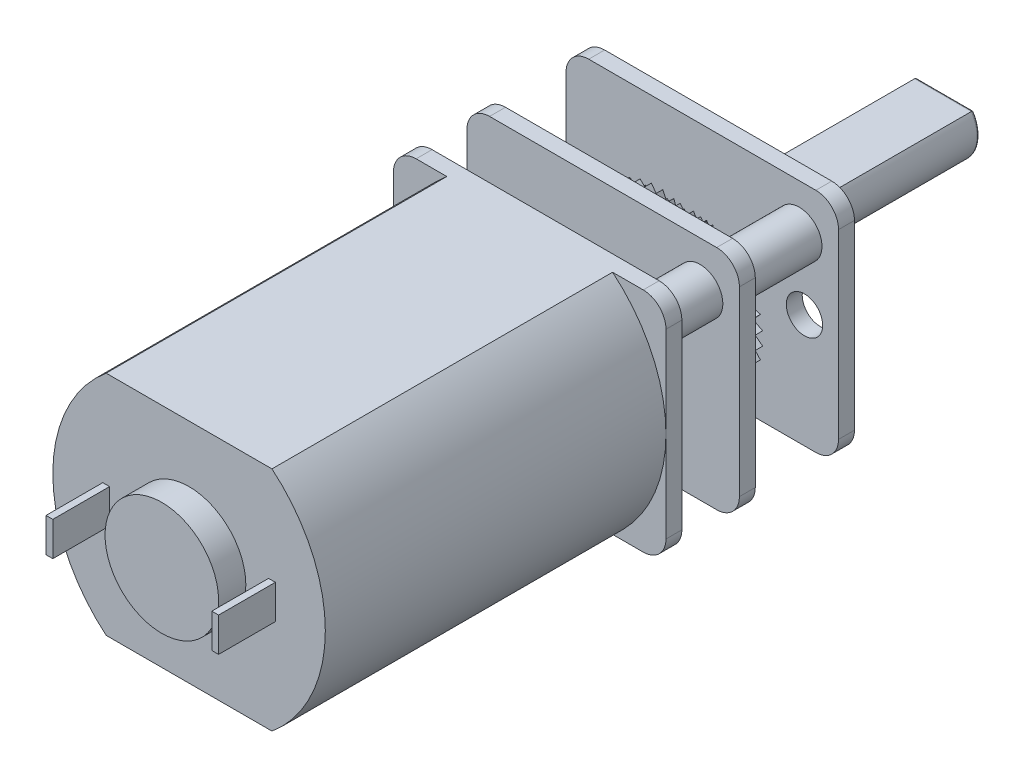
from build123d import *

# Parameters (mm, degrees)
BOSS_EXTRUDE1_DEPTH  = 9.3
SKETCH2_R            = 2
BOSS_EXTRUDE2_DEPTH  = 0.7
SKETCH3_W            = 12
SKETCH3_H            = 10
BOSS_EXTRUDE3_DEPTH  = 0.7
SKETCH4_R            = 0.8
CUT_EXTRUDE1_DEPTH   = 13.68857754
FILLET1_R            = 1
SKETCH4_3_R          = 1
BOSS_EXTRUDE5_DEPTH  = 7.6
BOSS_EXTRUDE6_START  = 0.7
BOSS_EXTRUDE6_DEPTH  = 0.7
BOSS_EXTRUDE7_DEPTH  = 15
SKETCH7_R            = 2.5
BOSS_EXTRUDE8_DEPTH  = 1.2
SKETCH7_3_W          = 0.3
SKETCH7_3_H          = 1.5
BOSS_EXTRUDE9_DEPTH  = 2.5
BOSS_EXTRUDE10_DEPTH = 0.7
FILLET2_R            = 0.1
BOSS_EXTRUDE11_DEPTH = 1
BOSS_EXTRUDE12_DEPTH = 1
BOSS_EXTRUDE13_DEPTH = 1
BOSS_EXTRUDE14_DEPTH = 0.67
SKETCH14_R           = 1
BOSS_EXTRUDE15_DEPTH = 2.5


with BuildPart() as part:
    # Sketch1 → Boss-Extrude1 (new body)
    with BuildSketch(Plane.XY):
        with BuildLine():
            Line((-1.25, 0.829156198), (1.25, 0.829156198))
            ThreePointArc((1.25, 0.829156198), (0, -1.5), (-1.25, 0.829156198))
        make_face()
    extrude(amount=BOSS_EXTRUDE1_DEPTH)

    # Sketch2 → Boss-Extrude2 (add)
    with BuildSketch(Plane.XY.offset(9.3)):
        Circle(SKETCH2_R)
    extrude(amount=BOSS_EXTRUDE2_DEPTH)

    # Sketch3 → Boss-Extrude3 (add)
    with BuildSketch(Plane.XY.offset(10)):
        Rectangle(SKETCH3_W, SKETCH3_H)
    extrude(amount=BOSS_EXTRUDE3_DEPTH)

    # Sketch4 → Cut-Extrude1 (cut, through all)
    with BuildSketch(Plane(origin=(0, 0, 10), x_dir=(-1, 0, 0), z_dir=(0, 0, -1))):
        with Locations((-4.5, 0)):
            Circle(SKETCH4_R)
        with Locations((4.5, 0)):
            Circle(SKETCH4_R)
    extrude(amount=-CUT_EXTRUDE1_DEPTH, mode=Mode.SUBTRACT)

    # Fillet1
    fillet1_edges = [part.edges().sort_by_distance(p)[0] for p in [
        (6, 5, 10.35),
        (-6, -5, 10.35),
        (-6, 5, 10.35),
        (6, -5, 10.35),
    ]]
    fillet(fillet1_edges, radius=FILLET1_R)

    # Sketch4<3> → Boss-Extrude5 (add)
    with BuildSketch(Plane(origin=(0, 0, 10), x_dir=(-1, 0, 0), z_dir=(0, 0, -1))):
        with Locations((-4.270143761, 2.989986851)):
            Circle(SKETCH4_3_R)
        with Locations((4.465452114, -3.126743232)):
            Circle(SKETCH4_3_R)
    extrude(amount=-BOSS_EXTRUDE5_DEPTH)

    # Sketch5 → Boss-Extrude6 (add)
    with BuildSketch(Plane.XY.offset(17.6).offset(BOSS_EXTRUDE6_START)):
        with BuildLine():
            Line((5, -5), (-5, -5))
            ThreePointArc((-5, -5), (-5.707106781, -4.707106781), (-6, -4))
            Line((-6, -4), (-6, 4))
            ThreePointArc((-6, 4), (-5.707106781, 4.707106781), (-5, 5))
            Line((-5, 5), (5, 5))
            ThreePointArc((5, 5), (5.707106781, 4.707106781), (6, 4))
            Line((6, 4), (6, -4))
            ThreePointArc((6, -4), (5.707106781, -4.707106781), (5, -5))
        make_face()
    extrude(amount=-BOSS_EXTRUDE6_DEPTH)

    # Sketch6 → Boss-Extrude7 (add)
    with BuildSketch(Plane.XY.offset(18.3)):
        with BuildLine():
            Line((-3.65, -5), (3.65, -5))
            ThreePointArc((3.65, -5), (6, 0), (3.65, 5))
            Line((3.65, 5), (-3.65, 5))
            ThreePointArc((-3.65, 5), (-6.000009851, 0), (-3.65, -5))
        make_face()
    extrude(amount=BOSS_EXTRUDE7_DEPTH)

    # Sketch7 → Boss-Extrude8 (add)
    with BuildSketch(Plane.XY.offset(33.3)):
        Circle(SKETCH7_R)
    extrude(amount=BOSS_EXTRUDE8_DEPTH)

    # Sketch7<3> → Boss-Extrude9 (add)
    with BuildSketch(Plane.XY.offset(33.3)):
        with Locations((3.65, 0)):
            Rectangle(SKETCH7_3_W, SKETCH7_3_H)
        with Locations((-3.65, 0)):
            Rectangle(SKETCH7_3_W, SKETCH7_3_H)
    extrude(amount=BOSS_EXTRUDE9_DEPTH)

    # Sketch8 → Boss-Extrude10 (add)
    with BuildSketch(Plane(origin=(0, 0, 15.066666667), x_dir=(-1, 0, 0), z_dir=(0, 0, -1))):
        with BuildLine():
            Line((5, -5), (-5, -5))
            ThreePointArc((-5, -5), (-5.707106781, -4.707106781), (-6, -4))
            Line((-6, -4), (-6, 4))
            ThreePointArc((-6, 4), (-5.707106781, 4.707106781), (-5, 5))
            Line((-5, 5), (5, 5))
            ThreePointArc((5, 5), (5.707106781, 4.707106781), (6, 4))
            Line((6, 4), (6, -4))
            ThreePointArc((6, -4), (5.707106781, -4.707106781), (5, -5))
        make_face()
    extrude(amount=BOSS_EXTRUDE10_DEPTH)

    # Fillet2
    fillet2_edges = [part.edges().sort_by_distance(p)[0] for p in [
        (0, 0.829156198, 0),
        (0, -1.5, 0),
    ]]
    fillet(fillet2_edges, radius=FILLET2_R)

    # Sketch10 → Boss-Extrude11 (add)
    with BuildSketch(Plane(origin=(0, 0, 14.366666667), x_dir=(-1, 0, 0), z_dir=(0, 0, -1))):
        Polygon((-2.301214258, -0.489223305), (-2.324023659, -0.906738437), (-1.939489044, -0.742506027), (-1.889451177, -1.157638977), (-1.539277165, -0.929127891), (-1.417912405, -1.329265054), (-1.112738858, -1.043418486), (-0.923734812, -1.416401897), (-0.672834272, -1.08190515), (-0.421933732, -1.416401897), (-0.232929686, -1.043418486), (0.072243861, -1.329265054), (0.193608621, -0.929127891), (0.543782632, -1.157638977), (0.5938205, -0.742506027), (0.978355115, -0.906738437), (0.955545714, -0.489223305), (1.362757043, -0.584186921), (1.267793427, -0.176975592), (1.685308559, -0.199784993), (1.521076149, 0.184749622), (1.936209099, 0.23478749), (1.707698013, 0.584961501), (2.107835176, 0.706326261), (1.821988608, 1.011499808), (2.194972019, 1.200503854), (1.860475272, 1.451404394), (2.194972019, 1.702304934), (1.821988608, 1.89130898), (2.107835176, 2.196482527), (1.707698013, 2.317847287), (1.936209099, 2.668021298), (1.521076149, 2.718059166), (1.685308559, 3.102593781), (1.267793427, 3.07978438), (1.362757043, 3.486995709), (0.955545714, 3.392032093), (0.978355115, 3.809547226), (0.5938205, 3.645314815), (0.543782632, 4.060447765), (0.193608621, 3.831936679), (0.072243861, 4.232073842), (-0.232929686, 3.946227274), (-0.421933732, 4.319210685), (-0.672834272, 3.984713938), (-0.923734812, 4.319210685), (-1.112738858, 3.946227274), (-1.417912405, 4.232073842), (-1.539277165, 3.831936679), (-1.889451177, 4.060447765), (-1.939489044, 3.645314815), (-2.324023659, 3.809547226), (-2.301214258, 3.392032093), (-2.708425587, 3.486995709), (-2.613461971, 3.07978438), (-3.030977104, 3.102593781), (-2.866744693, 2.718059166), (-3.281877643, 2.668021298), (-3.053366557, 2.317847287), (-3.45350372, 2.196482527), (-3.167657152, 1.89130898), (-3.540640563, 1.702304934), (-3.206143816, 1.451404394), (-3.540640563, 1.200503854), (-3.167657152, 1.011499808), (-3.45350372, 0.706326261), (-3.053366557, 0.584961501), (-3.281877643, 0.23478749), (-2.866744693, 0.184749622), (-3.030977104, -0.199784993), (-2.613461971, -0.176975592), (-2.708425587, -0.584186921), align=None)
    extrude(amount=BOSS_EXTRUDE11_DEPTH)

    # Sketch11 → Boss-Extrude12 (add)
    with BuildSketch(Plane(origin=(0, 0, 13.366666667), x_dir=(-1, 0, 0), z_dir=(0, 0, -1))):
        Polygon((-0.085963291, -0.110713803), (-0.101270064, -0.390896944), (0.156780741, -0.280685004), (0.190359804, -0.559269526), (0.425352135, -0.405921902), (0.506796751, -0.674443156), (0.711590484, -0.482619236), (0.838426, -0.73291834), (1.006798583, -0.508446598), (1.175171166, -0.73291834), (1.302006681, -0.482619236), (1.506800415, -0.674443156), (1.588245031, -0.405921902), (1.823237362, -0.559269526), (1.856816425, -0.280685004), (2.11486723, -0.390896944), (2.099560457, -0.110713803), (2.372828993, -0.174441324), (2.309101472, 0.098827212), (2.589284612, 0.083520439), (2.479072673, 0.341571244), (2.757657195, 0.375150307), (2.60430957, 0.610142637), (2.872830825, 0.691587253), (2.681006905, 0.896380987), (2.931306009, 1.023216503), (2.706834267, 1.191589086), (2.931306009, 1.359961668), (2.681006905, 1.486797184), (2.872830825, 1.691590918), (2.60430957, 1.773035534), (2.757657195, 2.008027865), (2.479072673, 2.041606928), (2.589284613, 2.299657733), (2.309101472, 2.28435096), (2.372828993, 2.557619495), (2.099560457, 2.493891975), (2.11486723, 2.774075115), (1.856816425, 2.663863176), (1.823237362, 2.942447698), (1.588245031, 2.789100073), (1.506800415, 3.057621328), (1.302006681, 2.865797408), (1.175171166, 3.116096512), (1.006798583, 2.89162477), (0.838426, 3.116096512), (0.711590484, 2.865797408), (0.506796751, 3.057621328), (0.425352135, 2.789100073), (0.190359804, 2.942447698), (0.156780741, 2.663863176), (-0.101270064, 2.774075115), (-0.085963291, 2.493891975), (-0.359231827, 2.557619495), (-0.295504306, 2.28435096), (-0.575687447, 2.299657733), (-0.465475507, 2.041606928), (-0.744060029, 2.008027865), (-0.590712404, 1.773035534), (-0.859233659, 1.691590918), (-0.667409739, 1.486797184), (-0.917708843, 1.359961668), (-0.693237101, 1.191589086), (-0.917708843, 1.023216503), (-0.667409739, 0.896380987), (-0.859233659, 0.691587253), (-0.590712404, 0.610142637), (-0.744060029, 0.375150307), (-0.465475507, 0.341571244), (-0.575687447, 0.083520439), (-0.295504306, 0.098827212), (-0.359231827, -0.174441324), align=None)
    extrude(amount=BOSS_EXTRUDE12_DEPTH)

    # Sketch12 → Boss-Extrude13 (add)
    with BuildSketch(Plane(origin=(0, 0, 12.366666667), x_dir=(-1, 0, 0), z_dir=(0, 0, -1))):
        Polygon((-1.884371446, -3.414168008), (-1.91093216, -3.900349136), (-1.46315564, -3.70910649), (-1.40488837, -4.192513654), (-0.997123519, -3.926420837), (-0.855798687, -4.392365955), (-0.500435232, -4.059508062), (-0.280346921, -4.493833627), (0.011817597, -4.104324378), (0.303982115, -4.493833627), (0.524070426, -4.059508062), (0.87943388, -4.392365955), (1.020758713, -3.926420837), (1.428523564, -4.192513654), (1.486790834, -3.70910649), (1.934567354, -3.900349136), (1.90800664, -3.414168008), (2.382189365, -3.524749672), (2.271607701, -3.050566946), (2.757788829, -3.07712766), (2.566546183, -2.629351141), (3.049953348, -2.571083871), (2.78386053, -2.16331902), (3.249805648, -2.021994187), (2.916947755, -1.666630733), (3.351273321, -1.446542422), (2.961764071, -1.154377904), (3.351273321, -0.862213386), (2.916947755, -0.642125074), (3.249805648, -0.28676162), (2.78386053, -0.145436788), (3.049953348, 0.262328063), (2.566546183, 0.320595333), (2.757788829, 0.768371853), (2.271607701, 0.741811139), (2.382189365, 1.215993864), (1.90800664, 1.1054122), (1.934567354, 1.591593329), (1.486790834, 1.400350682), (1.428523564, 1.883757847), (1.020758713, 1.617665029), (0.87943388, 2.083610148), (0.524070426, 1.750752255), (0.303982115, 2.18507782), (0.011817597, 1.79556857), (-0.280346921, 2.18507782), (-0.500435232, 1.750752255), (-0.855798686, 2.083610148), (-0.997123519, 1.617665029), (-1.40488837, 1.883757847), (-1.46315564, 1.400350682), (-1.91093216, 1.591593329), (-1.884371446, 1.1054122), (-2.358554171, 1.215993864), (-2.247972507, 0.741811139), (-2.734153636, 0.768371853), (-2.542910989, 0.320595333), (-3.026318154, 0.262328063), (-2.760225336, -0.145436788), (-3.226170454, -0.28676162), (-2.893312561, -0.642125074), (-3.327638127, -0.862213386), (-2.938128877, -1.154377904), (-3.327638127, -1.446542422), (-2.893312561, -1.666630733), (-3.226170454, -2.021994187), (-2.760225336, -2.16331902), (-3.026318154, -2.571083871), (-2.542910989, -2.629351141), (-2.734153636, -3.07712766), (-2.247972507, -3.050566946), (-2.358554171, -3.524749672), align=None)
    extrude(amount=BOSS_EXTRUDE13_DEPTH)

    # Sketch13 → Boss-Extrude14 (add)
    with BuildSketch(Plane(origin=(0, 0, 11.366666667), x_dir=(-1, 0, 0), z_dir=(0, 0, -1))):
        Polygon((-0.935982778, -1.137694072), (-0.948288501, -1.362944416), (-0.74083122, -1.274340665), (-0.713835679, -1.498305816), (-0.52491602, -1.375023576), (-0.459439462, -1.590898467), (-0.294797653, -1.436683606), (-0.19282955, -1.637908987), (-0.05746815, -1.457447247), (0.07789325, -1.637908987), (0.179861354, -1.436683606), (0.344503162, -1.590898467), (0.409979721, -1.375023576), (0.598899379, -1.498305816), (0.62589492, -1.274340665), (0.833352201, -1.362944416), (0.821046479, -1.137694072), (1.040737898, -1.188927155), (0.989504815, -0.969235736), (1.214755159, -0.981541458), (1.126151408, -0.774084177), (1.350116559, -0.747088636), (1.226834319, -0.558168977), (1.44270921, -0.492692419), (1.288494349, -0.328050611), (1.489719731, -0.226082507), (1.30925799, -0.090721107), (1.48971973, 0.044640293), (1.288494349, 0.146608396), (1.44270921, 0.311250205), (1.226834319, 0.376726763), (1.350116559, 0.565646422), (1.126151408, 0.592641963), (1.214755159, 0.800099244), (0.989504815, 0.787793522), (1.040737898, 1.00748494), (0.821046479, 0.956251858), (0.833352201, 1.181502202), (0.62589492, 1.09289845), (0.598899379, 1.316863602), (0.409979721, 1.193581361), (0.344503162, 1.409456252), (0.179861354, 1.255241392), (0.07789325, 1.456466773), (-0.05746815, 1.276005033), (-0.19282955, 1.456466773), (-0.294797653, 1.255241392), (-0.459439462, 1.409456252), (-0.52491602, 1.193581361), (-0.713835679, 1.316863601), (-0.74083122, 1.09289845), (-0.948288501, 1.181502202), (-0.935982778, 0.956251858), (-1.155674197, 1.00748494), (-1.104441115, 0.787793522), (-1.329691458, 0.800099244), (-1.241087707, 0.592641963), (-1.465052858, 0.565646422), (-1.341770618, 0.376726763), (-1.557645509, 0.311250205), (-1.403430649, 0.146608396), (-1.60465603, 0.044640293), (-1.42419429, -0.090721107), (-1.60465603, -0.226082507), (-1.403430649, -0.328050611), (-1.557645509, -0.492692419), (-1.341770618, -0.558168977), (-1.465052858, -0.747088636), (-1.241087707, -0.774084177), (-1.329691458, -0.981541458), (-1.104441115, -0.969235736), (-1.155674197, -1.188927155), align=None)
    extrude(amount=BOSS_EXTRUDE14_DEPTH)

    # Sketch14 → Boss-Extrude15 (add)
    with BuildSketch(Plane(origin=(0, 0, 17.6), x_dir=(-1, 0, 0), z_dir=(0, 0, -1))):
        with Locations((-0.615009408, 1.276491336)):
            Circle(SKETCH14_R)
    extrude(amount=BOSS_EXTRUDE15_DEPTH)


solid = part.part
